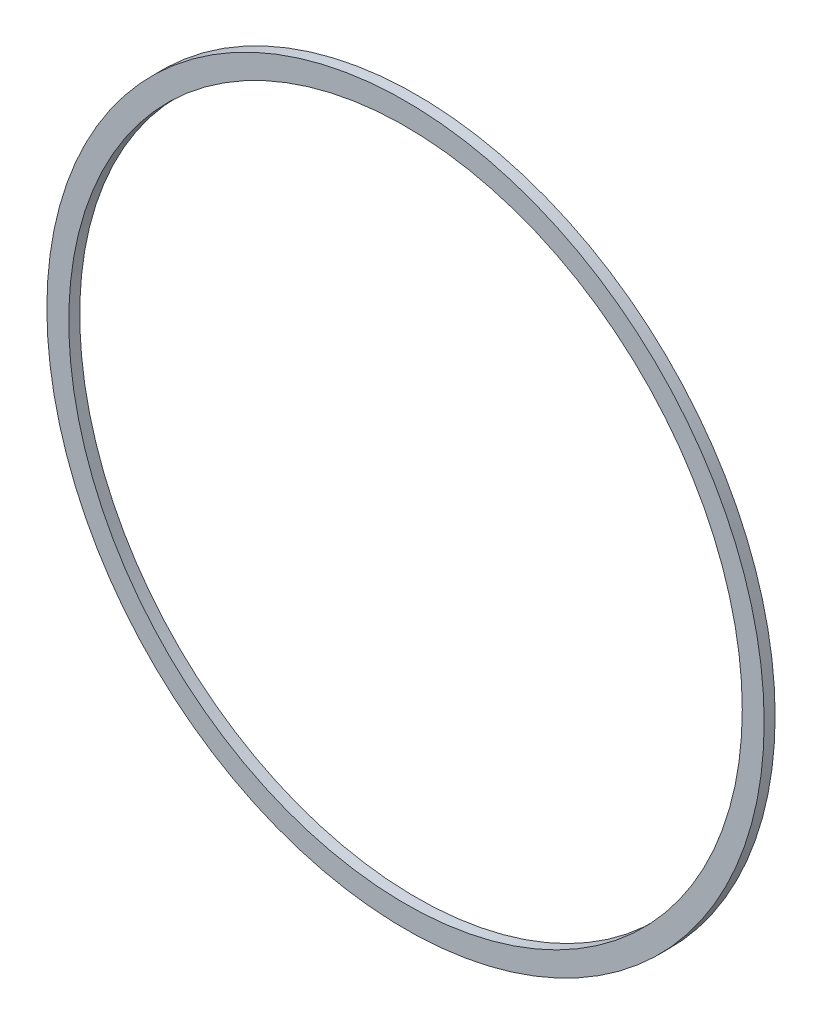
from build123d import *

# Parameters (mm, degrees)
SKETCH2_R           = 41.5925
SKETCH2_R_2         = 39.0525
BOSS_EXTRUDE1_DEPTH = 1.27


with BuildPart() as part:
    # Sketch2 → Boss-Extrude1 (new body)
    with BuildSketch(Plane.XY):
        Circle(SKETCH2_R)
        Circle(SKETCH2_R_2, mode=Mode.SUBTRACT)
    extrude(amount=BOSS_EXTRUDE1_DEPTH)


solid = part.part
